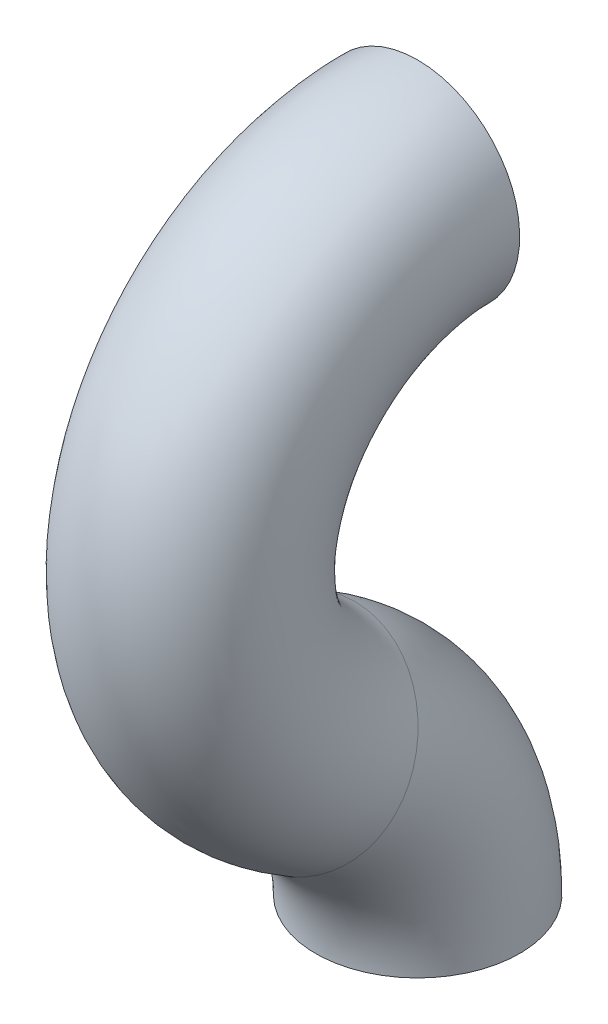
from build123d import *

# Parameters (mm, degrees)
SKETCH2_R = 23


with BuildPart() as part:
    # Sweep1: sweep along a path in Sketch1
    with BuildLine(Plane(origin=(0, 0, 0), x_dir=(0, 0, -1), z_dir=(1, 0, 0))) as sweep1_path:
        ThreePointArc((0, 0), (-6.865334795, 25.621778265), (-25.621778265, 44.378221735))
        ThreePointArc((-25.621778265, 44.378221735), (-49.497474683, 102.019251839), (0, 140))
    # Sketch2 → Sweep1 (sweep)
    with BuildSketch(Plane(origin=(0, 0, 0), x_dir=(1, 0, 0), z_dir=(0, 1, 0))):
        Circle(SKETCH2_R)
    sweep(path=sweep1_path.line)


solid = part.part
